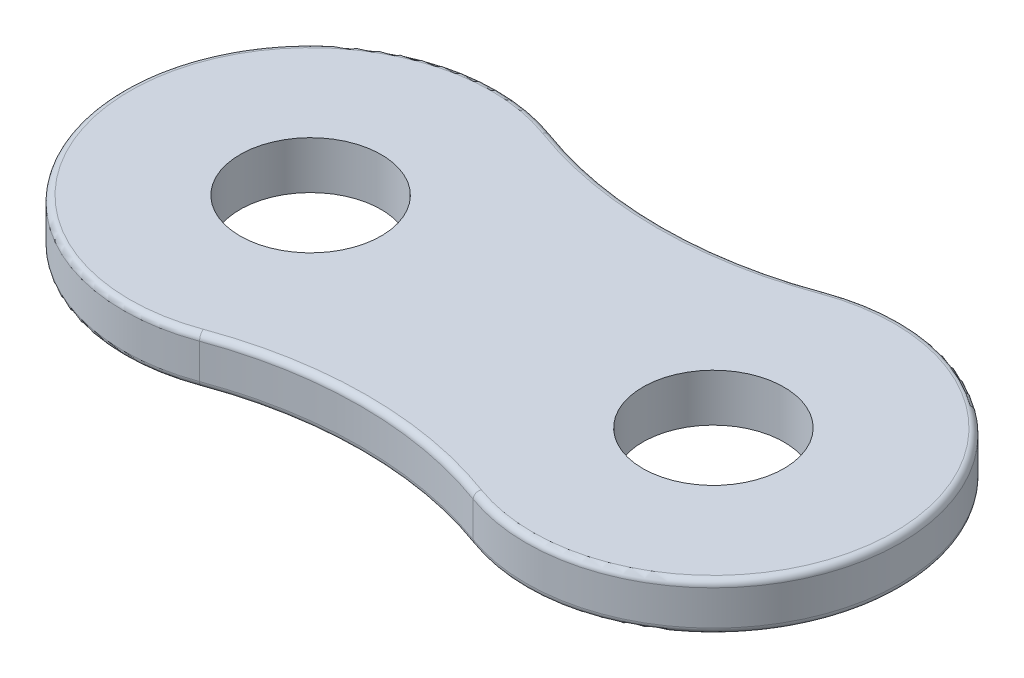
from build123d import *

# Parameters (mm, degrees)
SZKIC1_R                    = 2.225
DODANIE_WYCI_GNI_CIE1_DEPTH = 1.5
ZAOKR_GLENIE1_R             = 0.2


with BuildPart() as part:
    # Szkic1 → Dodanie-wyciągnięcie1 (new body)
    with BuildSketch(Plane(origin=(0, 0, 0), x_dir=(1, 0, 0), z_dir=(0, 1, 0))):
        with BuildLine():
            ThreePointArc((2.036141304, 5.537520076), (-5.9, 0), (2.036141304, -5.537520076))
            ThreePointArc((2.036141304, -5.537520076), (6.35, -4.769554134), (10.663858696, -5.537520076))
            ThreePointArc((10.663858696, -5.537520076), (18.6, 0), (10.663858696, 5.537520076))
            ThreePointArc((10.663858696, 5.537520076), (6.35, 4.769554134), (2.036141304, 5.537520076))
        make_face()
        with Locations(Location((0, 0, 0), (0, 0, 270))):
            Circle(SZKIC1_R, mode=Mode.SUBTRACT)
        with Locations(Location((12.7, 0, 0), (0, 0, 270))):
            Circle(SZKIC1_R, mode=Mode.SUBTRACT)
    extrude(amount=DODANIE_WYCI_GNI_CIE1_DEPTH)

    # Zaokrąglenie1
    zaokr_glenie1_edges = [part.edges().sort_by_distance(p)[0] for p in [
        (6.35, 1.5, 4.769554134),
        (18.6, 1.5, 0),
        (6.35, 1.5, -4.769554134),
        (18.6, 0, 0),
        (6.35, 0, 4.769554134),
        (-5.9, 0, 0),
        (6.35, 0, -4.769554134),
        (-5.9, 1.5, 0),
    ]]
    fillet(zaokr_glenie1_edges, radius=ZAOKR_GLENIE1_R)


solid = part.part
